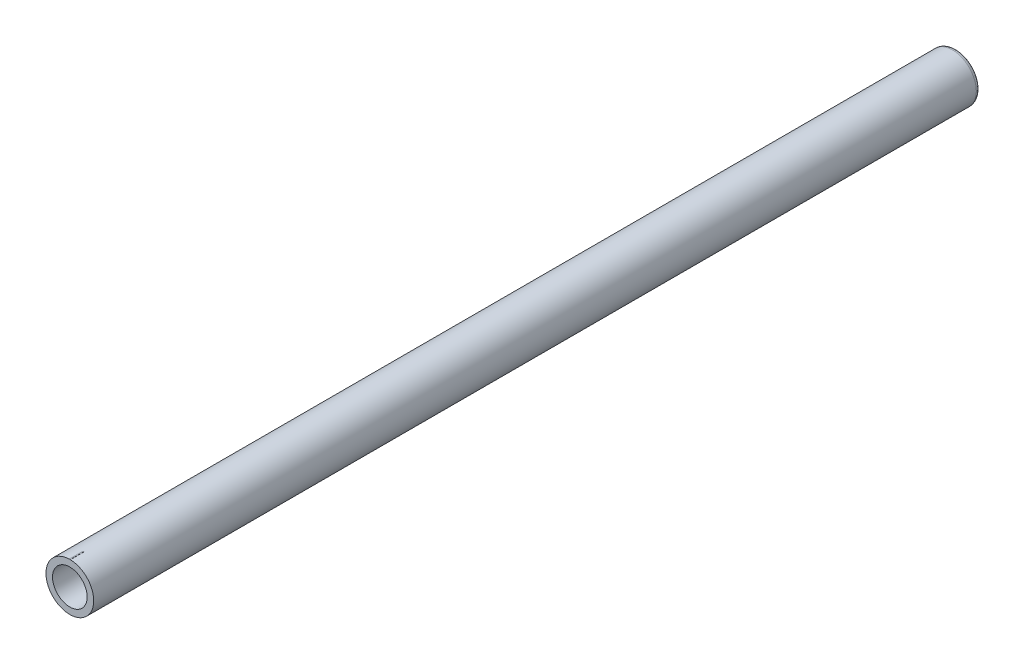
from build123d import *

# Parameters (mm, degrees)
CROQUIS2_R              = 17.5
SALIENTE_EXTRUIR1_DEPTH = 650
CROQUIS3_R              = 12.7
CORTAR_EXTRUIR1_DEPTH   = 640
REDONDEO1_R             = 3
CROQUIS4_W              = 0.7347375
CROQUIS4_H              = 0.188618068
SALIENTE_EXTRUIR2_DEPTH = 10


with BuildPart() as part:
    # Croquis2 → Saliente-Extruir1 (new body)
    with BuildSketch(Plane.XY):
        Circle(CROQUIS2_R)
    extrude(amount=-SALIENTE_EXTRUIR1_DEPTH)

    # Croquis3 → Cortar-Extruir1 (cut)
    with BuildSketch(Plane.XY):
        Circle(CROQUIS3_R)
    extrude(amount=-CORTAR_EXTRUIR1_DEPTH, mode=Mode.SUBTRACT)

    # Redondeo1
    redondeo1_edges = [part.edges().sort_by_distance(p)[0] for p in [
        (-17.5, 0, -650),
    ]]
    fillet(redondeo1_edges, radius=REDONDEO1_R)

    # Croquis4 → Saliente-Extruir2 (add)
    with BuildSketch(Plane.XY):
        with Locations((0, 17.5)):
            Rectangle(CROQUIS4_W, CROQUIS4_H)
    extrude(amount=-SALIENTE_EXTRUIR2_DEPTH)


solid = part.part
